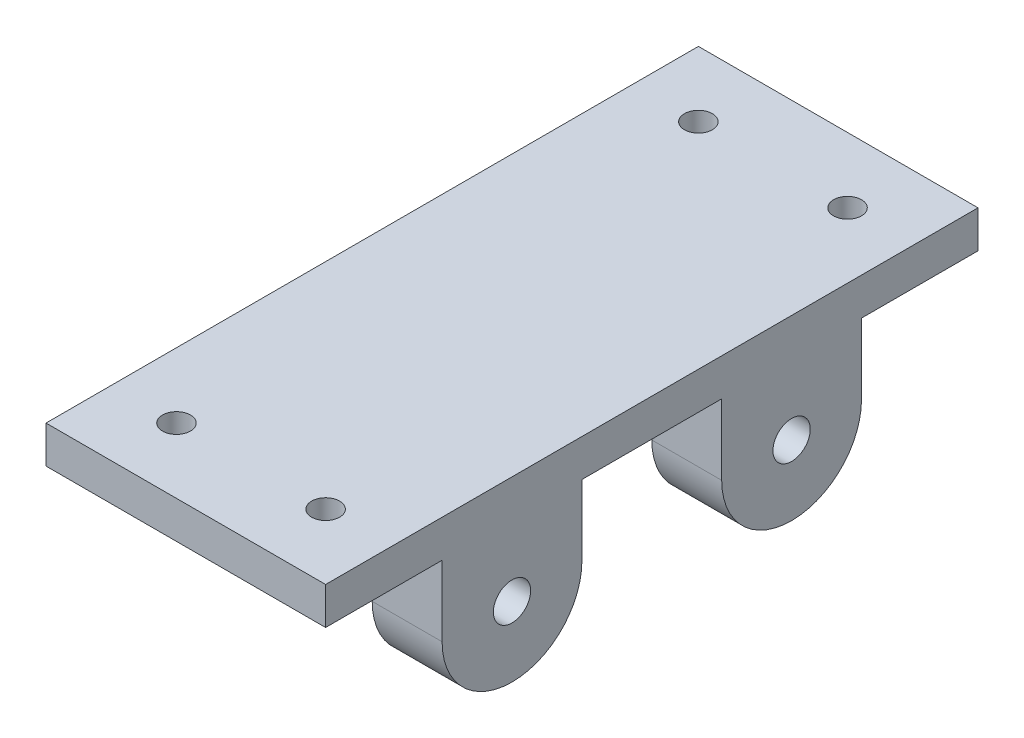
from build123d import *

# Parameters (mm, degrees)
SKETCH1_W           = 60
SKETCH1_H           = 140
BOSS_EXTRUDE1_DEPTH = 8
BOSS_EXTRUDE2_DEPTH = 60
CUT_EXTRUDE1_REACH  = 98.999
SKETCH5_R           = 4
SKETCH6_W           = 30
SKETCH6_H           = 30.146106113
CUT_EXTRUDE2_DEPTH  = 147.317421088
SKETCH7_R           = 3
CUT_EXTRUDE3_DEPTH  = 10


with BuildPart() as part:
    # Sketch1 → Boss-Extrude1 (new body)
    with BuildSketch(Plane(origin=(0, 0, 0), x_dir=(1, 0, 0), z_dir=(0, 1, 0))):
        Rectangle(SKETCH1_W, SKETCH1_H)
    extrude(amount=BOSS_EXTRUDE1_DEPTH)

    # Sketch3 → Boss-Extrude2 (add)
    with BuildSketch(Plane(origin=(30, 0, 0), x_dir=(0, 0, -1), z_dir=(1, 0, 0))):
        with BuildLine():
            Line((15, -15.146106113), (15, 0))
            Line((15, 0), (45, 0))
            Line((45, 0), (45, -15.146106113))
            ThreePointArc((45, -15.146106113), (30, -30.146106113), (15, -15.146106113))
        make_face()
    boss_extrude2 = extrude(amount=-BOSS_EXTRUDE2_DEPTH)

    # Mirror1: Boss-Extrude2 across plane
    add(boss_extrude2.mirror(Plane.XY))

    # Sketch5 → Cut-Extrude1 (cut, up to next)
    with BuildSketch(Plane(origin=(30, 0, 0), x_dir=(0, 0, -1), z_dir=(1, 0, 0)), mode=Mode.PRIVATE) as cut_extrude1_sk1:
        with Locations((30, -15.146106113)):
            Circle(SKETCH5_R)
    cut_extrude1_tool1 = extrude(cut_extrude1_sk1.sketch, amount=-CUT_EXTRUDE1_REACH, mode=Mode.PRIVATE) & part.part
    # Sketch5 → Cut-Extrude1 (cut, up to next)
    with BuildSketch(Plane(origin=(30, 0, 0), x_dir=(0, 0, -1), z_dir=(1, 0, 0)), mode=Mode.PRIVATE) as cut_extrude1_sk2:
        with Locations((-30, -15.146106113)):
            Circle(SKETCH5_R)
    cut_extrude1_tool2 = extrude(cut_extrude1_sk2.sketch, amount=-CUT_EXTRUDE1_REACH, mode=Mode.PRIVATE) & part.part
    add(cut_extrude1_tool1.solids().sort_by_distance((30, -15.146106, -30))[0], mode=Mode.SUBTRACT)
    add(cut_extrude1_tool2.solids().sort_by_distance((30, -15.146106, 30))[0], mode=Mode.SUBTRACT)

    # Sketch6 → Cut-Extrude2 (cut, through all)
    with BuildSketch(Plane.XY.offset(70)):
        with Locations((0, -15.073053057)):
            Rectangle(SKETCH6_W, SKETCH6_H)
    extrude(amount=-CUT_EXTRUDE2_DEPTH, mode=Mode.SUBTRACT)

    # Sketch7 → Cut-Extrude3 (cut)
    with BuildSketch(Plane.XZ):
        with Locations(Location((-16, -56, 0), (0, 0, 270))):
            Circle(SKETCH7_R)
        with Locations(Location((-16, 56, 0), (0, 0, 270))):
            Circle(SKETCH7_R)
        with Locations(Location((16, 56, 0), (0, 0, 270))):
            Circle(SKETCH7_R)
        with Locations(Location((16, -56, 0), (0, 0, 270))):
            Circle(SKETCH7_R)
    extrude(amount=-CUT_EXTRUDE3_DEPTH, mode=Mode.SUBTRACT)


solid = part.part
